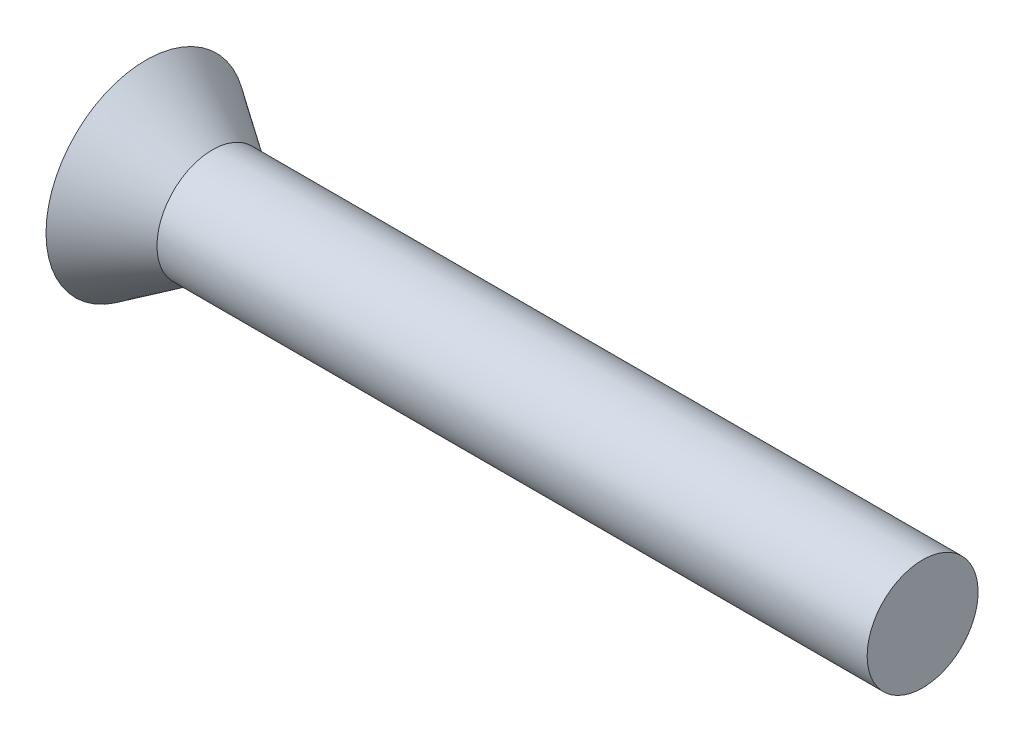
from build123d import *

# Parameters (mm, degrees)
SKETCH_2_W          = 1
SKETCH_2_H          = 1.75
SKETCH_2_W_2        = 1.75
SKETCH_2_H_2        = 1
CUT_EXTRUDE_1_DEPTH = 2


with BuildPart() as part:
    # Эскиз1 → Повернуть1 (revolve)
    with BuildSketch(Plane.XY, mode=Mode.PRIVATE) as revolve_1_sk:
        Polygon((-35, 0), (-35, 4.5), (-32, 2.5), (0, 2.5), (0, 0), align=None)
    revolve(revolve_1_sk.sketch.rotate(Axis((-51.630571285, 0, 0), (1, 0, 0)), 90), axis=Axis((-51.630571285, 0, 0), (1, 0, 0)))

    # Эскиз2 → Вырез-Вытянуть1 (cut)
    with BuildSketch(Plane.ZY.offset(35)):
        with Locations((0, 1.375)):
            Rectangle(SKETCH_2_W, SKETCH_2_H)
        with Locations((1.375, 0)):
            Rectangle(SKETCH_2_W_2, SKETCH_2_H_2)
        with Locations((0, -1.375)):
            Rectangle(SKETCH_2_W, SKETCH_2_H)
        with Locations((-1.375, 0)):
            Rectangle(SKETCH_2_W_2, SKETCH_2_H_2)
        Rectangle(SKETCH_2_W, SKETCH_2_H_2)
    extrude(amount=-CUT_EXTRUDE_1_DEPTH, mode=Mode.SUBTRACT)


solid = part.part
